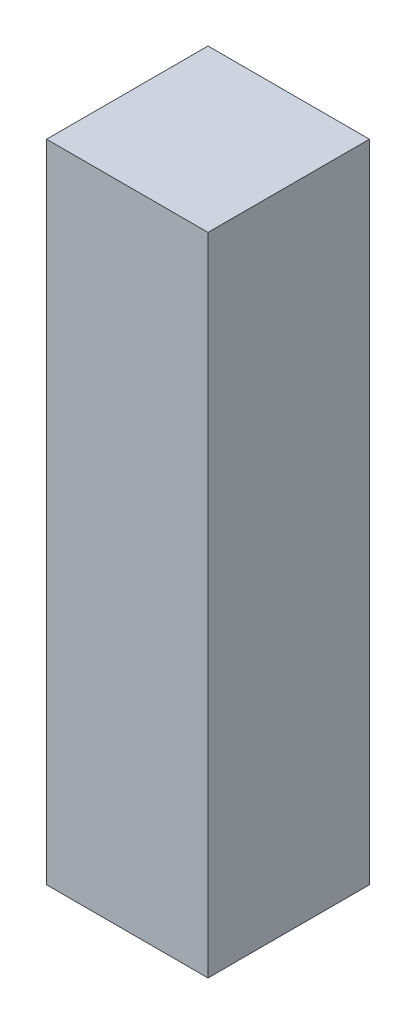
from build123d import *

# Parameters (mm, degrees)
SKETCH2_W             = 25
SKETCH2_H             = 25
BOSS_EXTRUDE2_DEPTH   = 100
SHELL2_T              = -3
BODY_MOVE_COPY1_ANGLE = 180


with BuildPart() as part:
    # Sketch2 → Boss-Extrude2 (new body)
    with BuildSketch(Plane(origin=(0, 0, 0), x_dir=(1, 0, 0), z_dir=(0, 1, 0))):
        Rectangle(SKETCH2_W, SKETCH2_H)
    extrude(amount=BOSS_EXTRUDE2_DEPTH)

    # Shell2
    shell2_openings = [part.faces().sort_by_distance(p)[0] for p in [
        (0, 100, 0),
    ]]
    offset(amount=SHELL2_T, openings=shell2_openings, kind=Kind.INTERSECTION)


with BuildPart() as part_1:
    # Body-Move/Copy1: moved
    add(part.part.rotate(Axis((0, 50, 0), (0, 0, 1)), BODY_MOVE_COPY1_ANGLE))


solid = part_1.part
